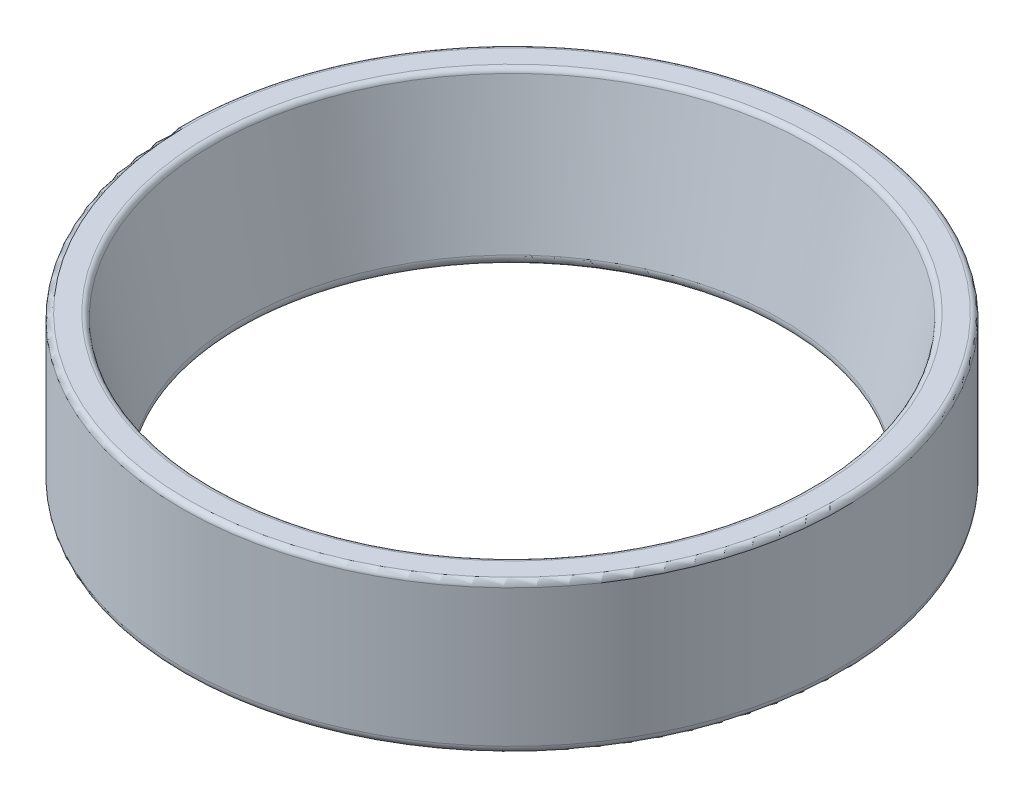
from build123d import *


with BuildPart() as part:
    # Sketch1 → Revolve1 (revolve)
    with BuildSketch(Plane.XY, mode=Mode.PRIVATE) as revolve1_sk:
        with BuildLine():
            Line((-30.5, 13.5), (-30.5, 0.8))
            ThreePointArc((-30.5, 0.8), (-30.265685425, 0.234314575), (-29.7, 0))
            Line((-29.7, 0), (-25.739589775, 0))
            ThreePointArc((-25.739589775, 0), (-25.117456905, 0.297057964), (-24.957347844, 0.967623271))
            Line((-24.957347844, 0.967623271), (-27.665306688, 13.604764544))
            ThreePointArc((-27.665306688, 13.604764544), (-27.839869123, 13.888833044), (-28.154207895, 14))
            Line((-28.154207895, 14), (-30, 14))
            ThreePointArc((-30, 14), (-30.353553391, 13.853553391), (-30.5, 13.5))
        make_face()
    revolve(revolve1_sk.sketch.rotate(Axis((0, 17.690895742, 0), (0, -1, 0)), 270), axis=Axis((0, 17.690895742, 0), (0, -1, 0)))


solid = part.part
